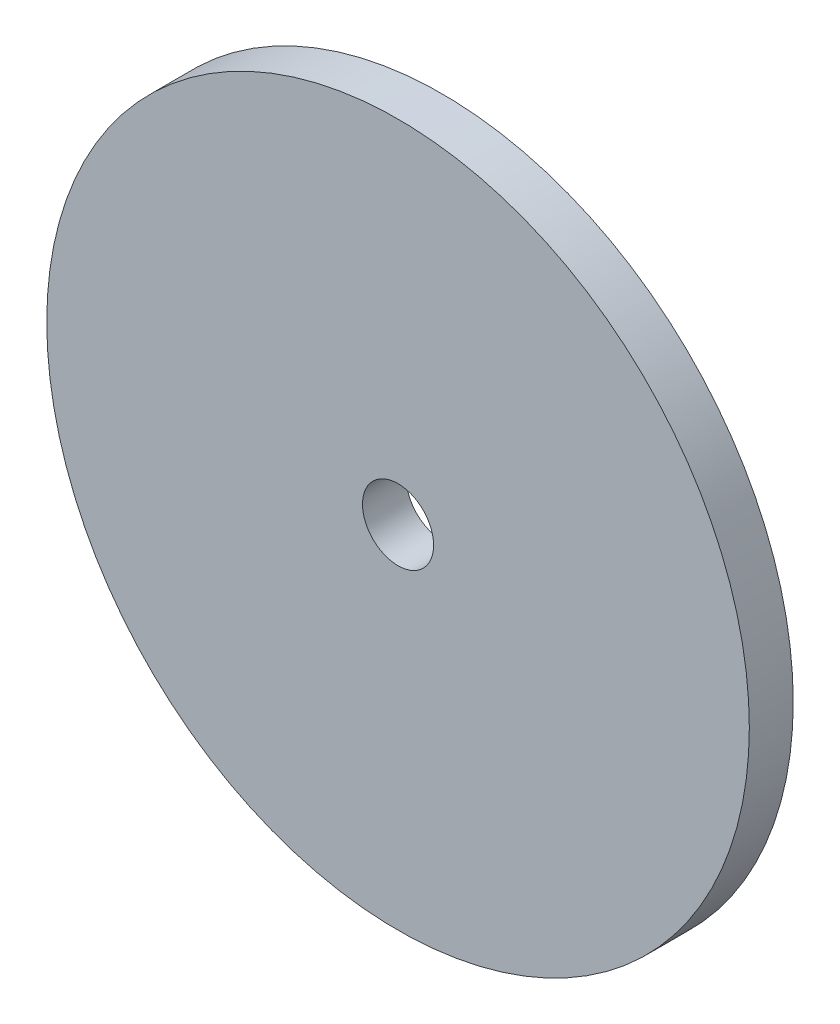
from build123d import *

# Parameters (mm, degrees)
SKETCH1_R           = 40
SKETCH1_R_2         = 4.05
BOSS_EXTRUDE1_DEPTH = 5


with BuildPart() as part:
    # Sketch1 → Boss-Extrude1 (new body)
    with BuildSketch(Plane.XY):
        Circle(SKETCH1_R)
        Circle(SKETCH1_R_2, mode=Mode.SUBTRACT)
    extrude(amount=BOSS_EXTRUDE1_DEPTH)


solid = part.part
